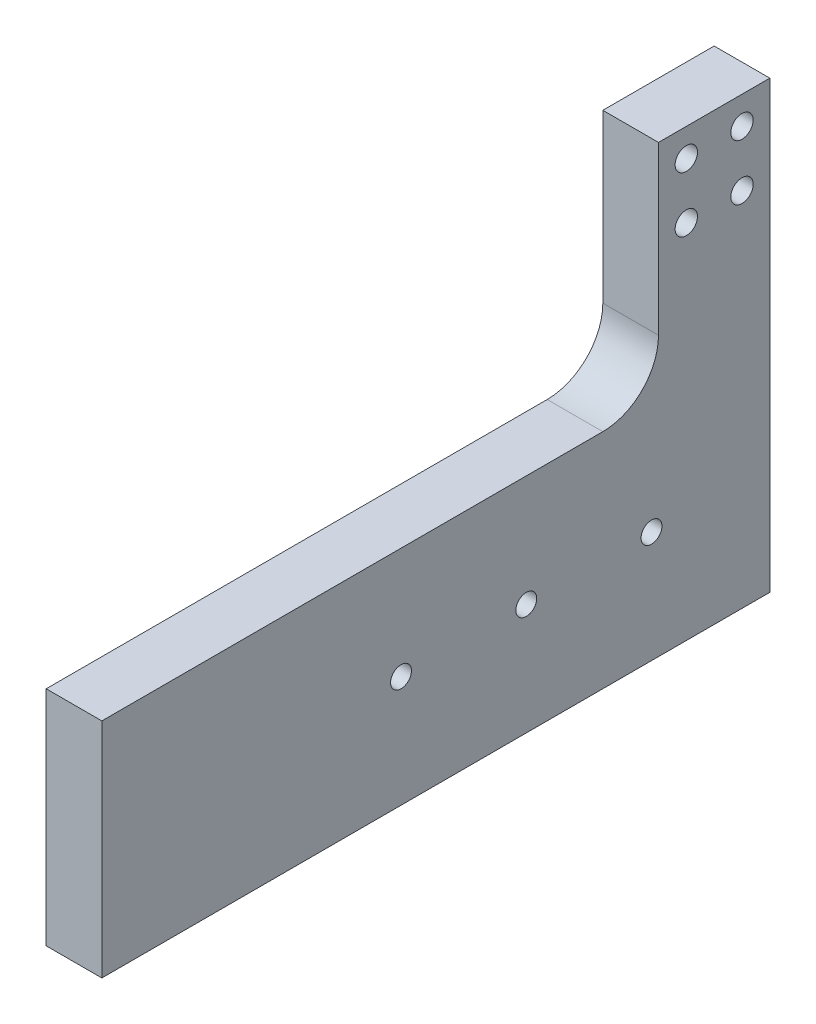
from build123d import *

# Parameters (mm, degrees)
SKETCH1_R              = 2.38125
BOSS_EXTRUDE1_DEPTH    = 12.7
F_10_CLEARANCE_HOLE1_D = 5.1054
FILLET1_R              = 12.7


with BuildPart() as part:
    # Sketch1 → Boss-Extrude1 (new body)
    with BuildSketch(Plane(origin=(0, 0, 0), x_dir=(0, 0, -1), z_dir=(1, 0, 0))):
        Polygon((0, 0), (0, 101.6), (-25.4, 101.6), (-25.4, 50.8), (-152.4, 50.8), (-152.4, 0), align=None)
        with Locations((-84.1375, 25.4)):
            Circle(SKETCH1_R, mode=Mode.SUBTRACT)
        with Locations((-55.5625, 25.4)):
            Circle(SKETCH1_R, mode=Mode.SUBTRACT)
        with Locations((-26.9875, 25.4)):
            Circle(SKETCH1_R, mode=Mode.SUBTRACT)
    extrude(amount=BOSS_EXTRUDE1_DEPTH)

    # #10 Clearance Hole1 (through all)
    with Locations(Plane(origin=(12.7, 0, 0), x_dir=(0, 0, -1), z_dir=(1, 0, 0))):
        with Locations((-19.05, 95.25), (-6.35, 95.25), (-6.35, 82.55), (-19.05, 82.55)):
            Hole(F_10_CLEARANCE_HOLE1_D / 2)

    # Fillet1
    fillet1_edges = [part.edges().sort_by_distance(p)[0] for p in [
        (6.35, 50.8, 25.4),
    ]]
    fillet(fillet1_edges, radius=FILLET1_R)


solid = part.part
